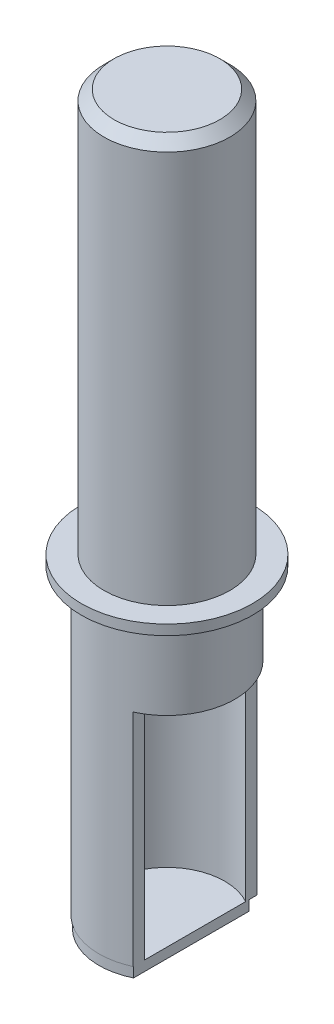
from build123d import *

# Parameters (mm, degrees)
SKETCH1_R               = 13.5
SKETCH1_R_2             = 11.5
BOSS_EXTRUDE1_DEPTH     = 60
SKETCH2_R               = 12.761832135
BOSS_EXTRUDE2_DEPTH     = 2
CUT_EXTRUDE1_DEPTH      = 63.964275585
CUT_EXTRUDE1_DEPTH_BACK = 63.964275585
SKETCH3_W               = 21.152552615
SKETCH3_H               = 52.02384562
SKETCH4_R               = 17
SKETCH4_R_2             = 3
BOSS_EXTRUDE3_DEPTH     = 2
SKETCH5_R               = 12.5
BOSS_EXTRUDE4_DEPTH     = 80
CHAMFER1_SIZE           = 2


with BuildPart() as part:
    # Sketch1 → Boss-Extrude1 (new body)
    with BuildSketch(Plane(origin=(0, 0, 0), x_dir=(1, 0, 0), z_dir=(0, 1, 0))):
        with Locations(Location((0, 0, 0), (0, 0, 90))):
            Circle(SKETCH1_R)
        with Locations(Location((0, 0, 0), (0, 0, 90))):
            Circle(SKETCH1_R_2, mode=Mode.SUBTRACT)
    extrude(amount=BOSS_EXTRUDE1_DEPTH)

    # Sketch2 → Boss-Extrude2 (add)
    with BuildSketch(Plane.XZ):
        with Locations(Location((0, 0.738167865, 0), (0, 0, 90))):
            Circle(SKETCH2_R)
    extrude(amount=BOSS_EXTRUDE2_DEPTH)

    # Sketch3 → Cut-Extrude1 (cut, two sides: drawn at the far end of the back side and taken through both)
    with BuildSketch(Plane.XY.offset(-CUT_EXTRUDE1_DEPTH_BACK)):
        with Locations((16.150259766, 17.780571755)):
            Rectangle(SKETCH3_W, SKETCH3_H)
    extrude(amount=CUT_EXTRUDE1_DEPTH + CUT_EXTRUDE1_DEPTH_BACK, mode=Mode.SUBTRACT)

    # Sketch4 → Boss-Extrude3 (add)
    with BuildSketch(Plane(origin=(0, 60, 0), x_dir=(1, 0, 0), z_dir=(0, 1, 0))):
        with Locations(Location((0, 0, 0), (0, 0, 270))):
            Circle(SKETCH4_R)
        with Locations(Location((0, 0, 0), (0, 0, 270))):
            Circle(SKETCH4_R_2, mode=Mode.SUBTRACT)
    extrude(amount=BOSS_EXTRUDE3_DEPTH)

    # Sketch5 → Boss-Extrude4 (add)
    with BuildSketch(Plane(origin=(0, 62, 0), x_dir=(1, 0, 0), z_dir=(0, 1, 0))):
        with Locations(Location((0, 0, 0), (0, 0, 270))):
            Circle(SKETCH5_R)
    extrude(amount=BOSS_EXTRUDE4_DEPTH)

    # Chamfer1
    chamfer1_edges = [part.edges().sort_by_distance(p)[0] for p in [
        (0, 142, -12.5),
    ]]
    chamfer(chamfer1_edges, length=CHAMFER1_SIZE)


solid = part.part
